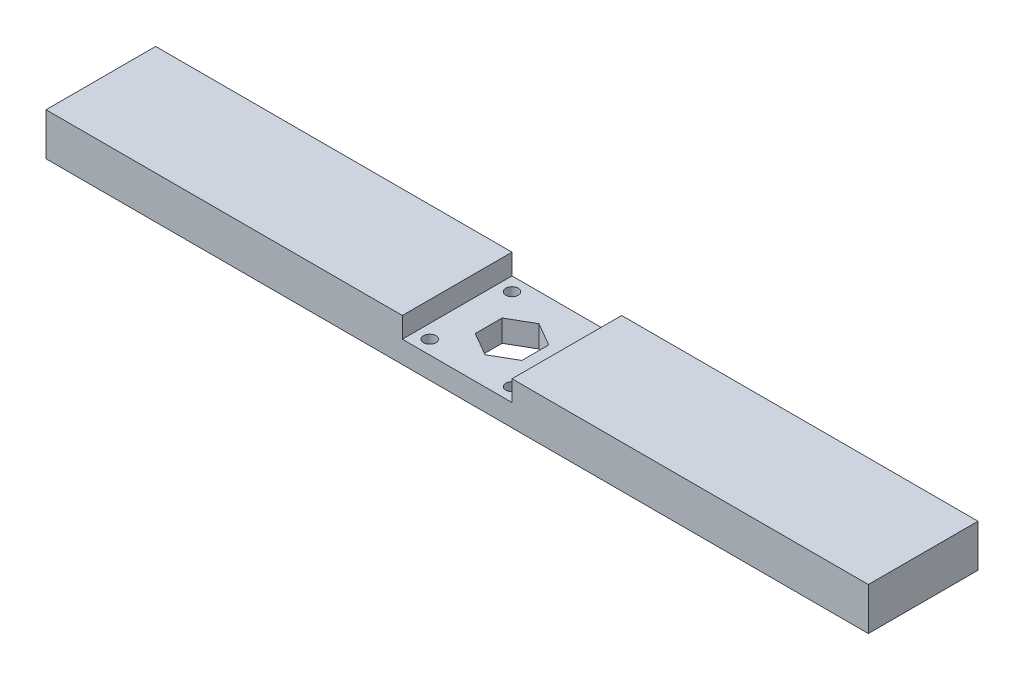
from build123d import *

# Parameters (mm, degrees)
BOSS_EXTRUDE1_DEPTH = 20
SKETCH2_R           = 2.25
CUT_EXTRUDE1_DEPTH  = 40


with BuildPart() as part:
    # Sketch1 → Boss-Extrude1 (new, symmetric)
    with BuildSketch(Plane.XY):
        Polygon((-150, 7.75), (-150, -7.75), (150, -7.75), (150, 7.75), (20, 7.75), (20, 0.25), (-20, 0.25), (-20, 7.75), align=None)
    extrude(amount=BOSS_EXTRUDE1_DEPTH, both=True)

    # Sketch2 → Cut-Extrude1 (cut)
    with BuildSketch(Plane(origin=(0, 0.25, 0), x_dir=(1, 0, 0), z_dir=(0, 1, 0))):
        with Locations(Location((15, 15, 0), (0, 0, 270))):
            Circle(SKETCH2_R)
        with Locations(Location((-15, 15, 0), (0, 0, 180))):
            Circle(SKETCH2_R)
        with Locations(Location((15, -15, 0), (0, 0, 180))):
            Circle(SKETCH2_R)
        with Locations(Location((-15, -15, 0), (0, 0, 270))):
            Circle(SKETCH2_R)
        Polygon((0, -9.814954576), (8.5, -4.907477288), (8.5, 4.907477288), (0, 9.814954576), (-8.5, 4.907477288), (-8.5, -4.907477288), align=None)
    extrude(amount=-CUT_EXTRUDE1_DEPTH, mode=Mode.SUBTRACT)


solid = part.part
